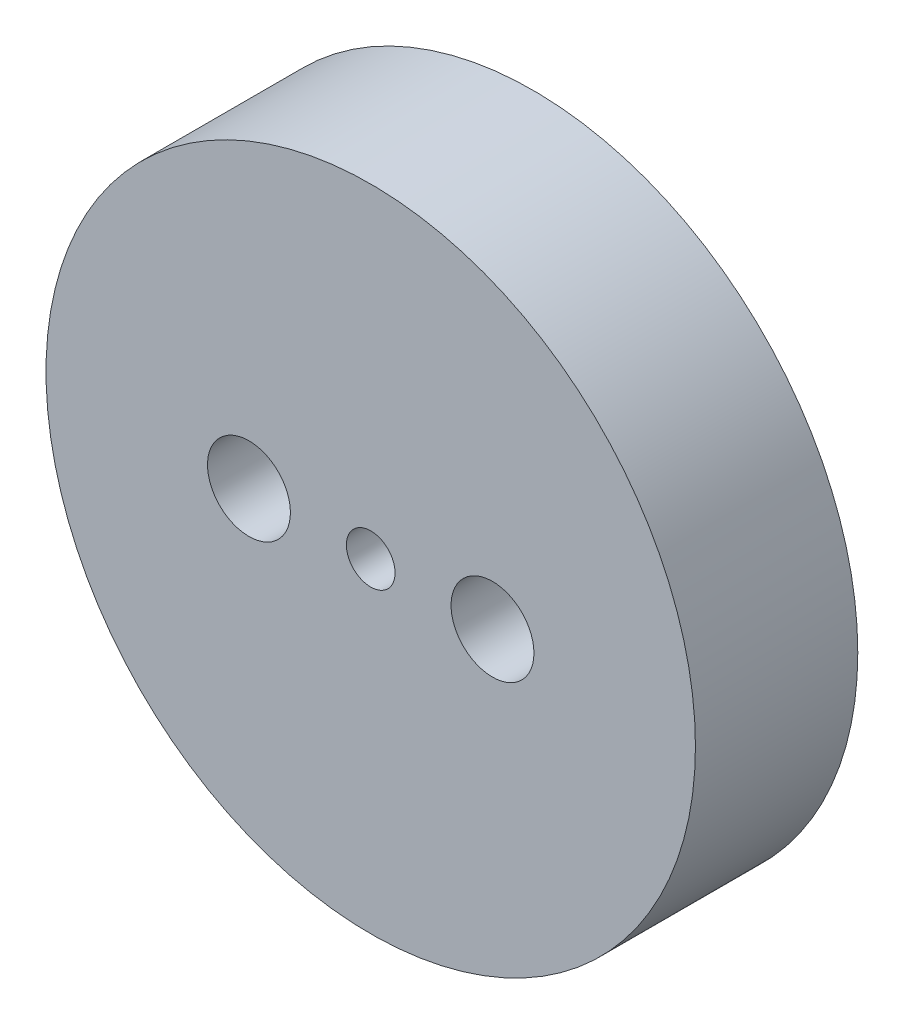
from build123d import *

# Parameters (mm, degrees)
SKETCH1_R               = 20
SKETCH1_R_2             = 1.5
BOSS_EXTRUDE1_DEPTH     = 10
F_1_4_20_TAPPED_HOLE1_D = 5.1054


with BuildPart() as part:
    # Sketch1 → Boss-Extrude1 (new body)
    with BuildSketch(Plane.XY):
        Circle(SKETCH1_R)
        Circle(SKETCH1_R_2, mode=Mode.SUBTRACT)
    extrude(amount=BOSS_EXTRUDE1_DEPTH)

    # 1/4-20 Tapped Hole1 (through all)
    with Locations(Plane.XY.offset(10)):
        with Locations((-7.5, 0), (7.5, 0)):
            Hole(F_1_4_20_TAPPED_HOLE1_D / 2)


solid = part.part
